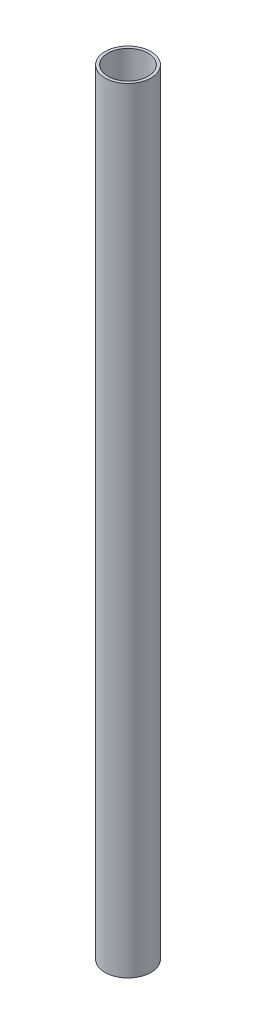
from build123d import *

# Parameters (mm, degrees)
SKETCH_1_R      = 8
SKETCH_1_R_2    = 7
EXTRUDE_1_DEPTH = 270


with BuildPart() as part:
    # 草图1 → 凸台-拉伸1 (new body)
    with BuildSketch(Plane(origin=(0, 0, 0), x_dir=(1, 0, 0), z_dir=(0, 1, 0))):
        with Locations(Location((0, 0, 0), (0, 0, 270))):
            Circle(SKETCH_1_R)
        with Locations(Location((0, 0, 0), (0, 0, 270))):
            Circle(SKETCH_1_R_2, mode=Mode.SUBTRACT)
    extrude(amount=EXTRUDE_1_DEPTH)


solid = part.part
